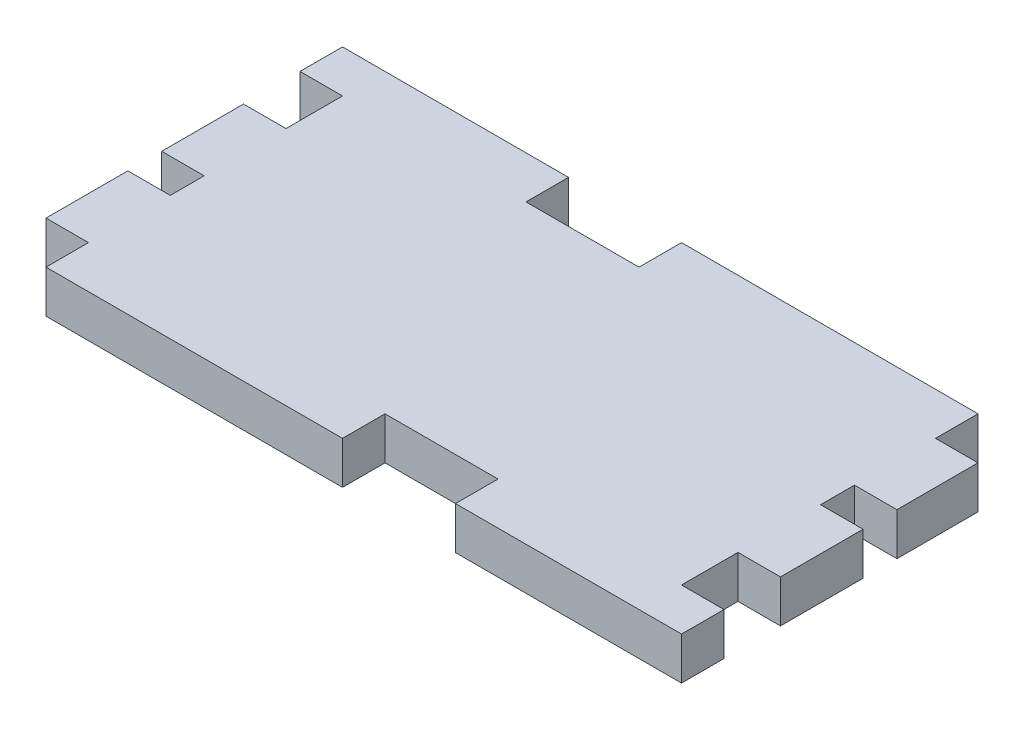
from build123d import *

# Parameters (mm, degrees)
SKETCH2_W           = 76.2
SKETCH2_H           = 38.1
BOSS_EXTRUDE1_DEPTH = 4.7752
SKETCH3_W           = 4.7752
SKETCH3_H           = 6.35
SKETCH3_H_2         = 4.7752
SKETCH3_H_3         = 3.81
SKETCH3_W_2         = 12.7
CUT_EXTRUDE1_DEPTH  = 6.35


with BuildPart() as part:
    # Sketch2 → Boss-Extrude1 (new body)
    with BuildSketch(Plane(origin=(0, 0, 0), x_dir=(1, 0, 0), z_dir=(0, 1, 0))):
        Rectangle(SKETCH2_W, SKETCH2_H)
    extrude(amount=BOSS_EXTRUDE1_DEPTH)

    # Sketch3 → Cut-Extrude1 (cut)
    with BuildSketch(Plane(origin=(0, 4.7752, 0), x_dir=(1, 0, 0), z_dir=(0, 1, 0))):
        with Locations((-35.7124, 11.0998)):
            Rectangle(SKETCH3_W, SKETCH3_H)
        with Locations((-35.7124, -16.6624)):
            Rectangle(SKETCH3_W, SKETCH3_H_2)
        with Locations((35.7124, 16.6624)):
            Rectangle(SKETCH3_W, SKETCH3_H_2)
        with Locations((-35.7124, -3.175)):
            Rectangle(SKETCH3_W, SKETCH3_H_3)
        with Locations((35.7124, -11.0998)):
            Rectangle(SKETCH3_W, SKETCH3_H)
        with Locations((35.7124, 3.259200717)):
            Rectangle(SKETCH3_W, SKETCH3_H_3)
        with Locations((-6.35, 16.6624)):
            Rectangle(SKETCH3_W_2, SKETCH3_H_2)
        with Locations((6.35, -16.6624)):
            Rectangle(SKETCH3_W_2, SKETCH3_H_2)
    extrude(amount=-CUT_EXTRUDE1_DEPTH, mode=Mode.SUBTRACT)


solid = part.part
